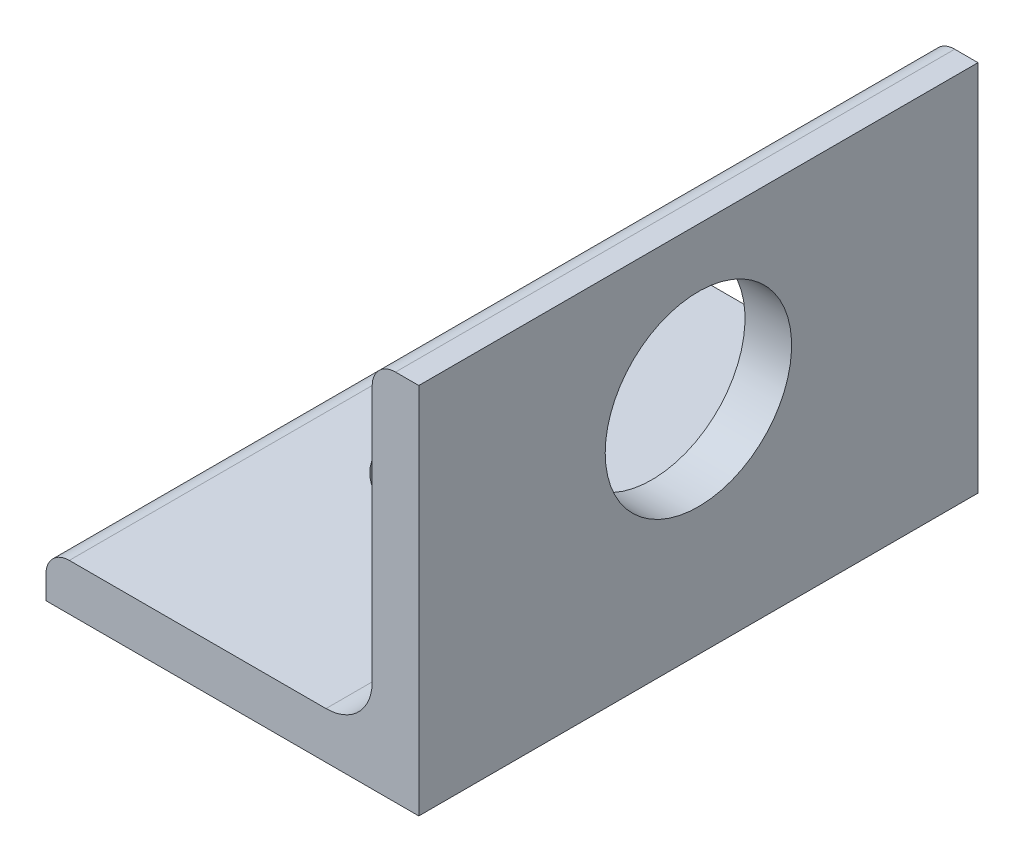
from build123d import *

# Parameters (mm, degrees)
BOSS_EXTRUDE1_DEPTH         = 9.525
F_6_0_204_DIAMETER_HOLE1_D  = 5.1816
F_1_4_0_25_DIAMETER_HOLE1_D = 6.35


with BuildPart() as part:
    # Sketch2 → Boss-Extrude1 (new, symmetric)
    with BuildSketch(Plane.XY):
        with BuildLine():
            Line((-6.35, 0), (6.35, 0))
            Line((6.35, 0), (6.35, 12.7))
            Line((6.35, 12.7), (5.55625, 12.7))
            ThreePointArc((5.55625, 12.7), (4.994983992, 12.467516008), (4.7625, 11.90625))
            Line((4.7625, 11.90625), (4.7625, 3.1623))
            ThreePointArc((4.7625, 3.1623), (4.301251759, 2.048748241), (3.1877, 1.5875))
            Line((3.1877, 1.5875), (-5.55625, 1.5875))
            ThreePointArc((-5.55625, 1.5875), (-6.117516008, 1.355016008), (-6.35, 0.79375))
            Line((-6.35, 0.79375), (-6.35, 0))
        make_face()
    extrude(amount=BOSS_EXTRUDE1_DEPTH, both=True)

    # #6 (0.204) Diameter Hole1 (through all)
    with Locations(Plane(origin=(0, 1.5875, 0), x_dir=(1, 0, 0), z_dir=(0, 1, 0))):
        with Locations((-1.184275, 0)):
            Hole(F_6_0_204_DIAMETER_HOLE1_D / 2)

    # 1/4 (0.25) Diameter Hole1 (through all)
    with Locations(Plane.ZY.offset(-4.7625)):
        with Locations((0, 7.534275)):
            Hole(F_1_4_0_25_DIAMETER_HOLE1_D / 2)


solid = part.part
